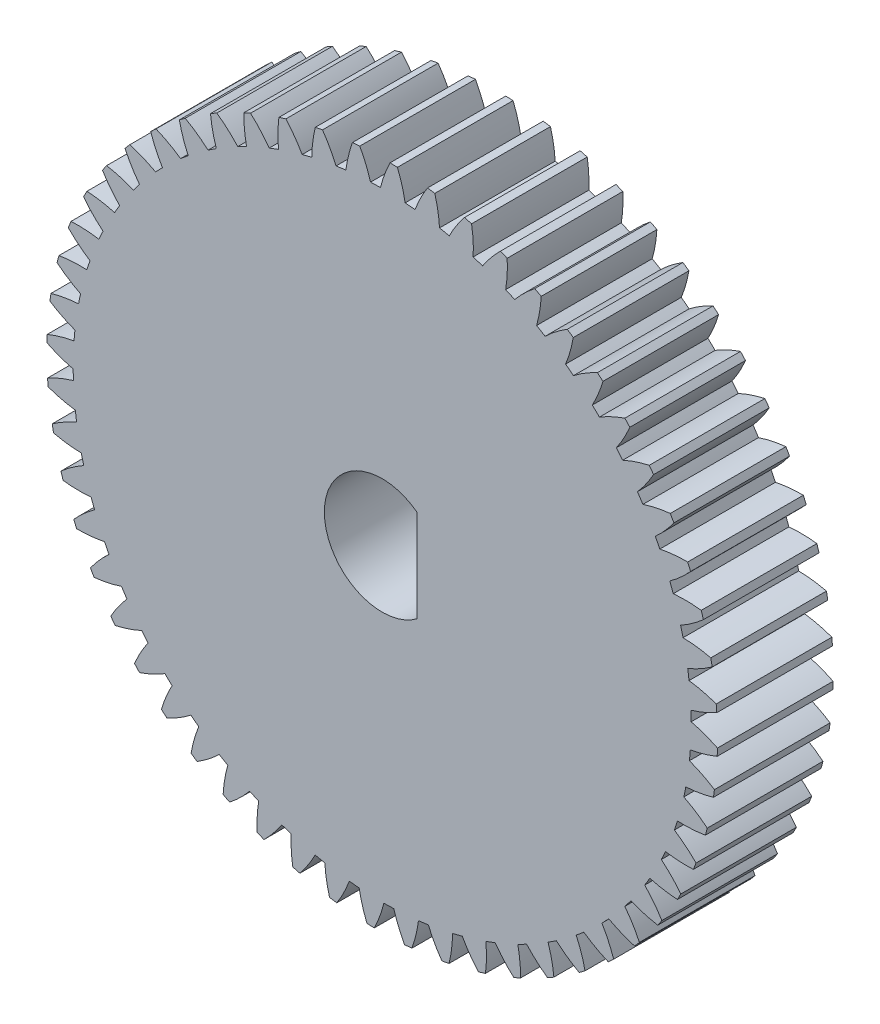
from build123d import *

# Parameters (mm, degrees)
BOSS_EXTRUDE1_DEPTH = 6.35


with BuildPart() as part:
    # Sketch1 → Boss-Extrude1 (new body)
    with BuildSketch(Plane.XY):
        with BuildLine():
            ThreePointArc((-17.851990054, 4.518702925), (-17.230016899, 4.06571305), (-16.562746604, 3.682567142))
            ThreePointArc((-16.562746604, 3.682567142), (-16.61965201, 3.416583514), (-16.672286231, 3.149721838))
            ThreePointArc((-16.672286231, 3.149721838), (-17.436587202, 3.060871069), (-18.186816361, 2.889971564))
            ThreePointArc((-18.186816361, 2.889971564), (-18.217335033, 2.690897492), (-18.245674693, 2.491501556))
            ThreePointArc((-18.245674693, 2.491501556), (-17.576893601, 2.110998884), (-16.870920231, 1.804972686))
            ThreePointArc((-16.870920231, 1.804972686), (-16.89768711, 1.534290124), (-16.92011135, 1.263213255))
            ThreePointArc((-16.92011135, 1.263213255), (-17.669658427, 1.089346603), (-18.396035629, 0.835522664))
            ThreePointArc((-18.396035629, 0.835522664), (-18.404073181, 0.63428332), (-18.409909386, 0.432968109))
            ThreePointArc((-18.409909386, 0.432968109), (-17.702730667, 0.129737682), (-16.966932247, -0.095320348))
            ThreePointArc((-16.966932247, -0.095320348), (-16.96322399, -0.367297855), (-16.955156252, -0.639180968))
            ThreePointArc((-16.955156252, -0.639180968), (-17.680523445, -0.895877029), (-18.373914076, -1.229433419))
            ThreePointArc((-18.373914076, -1.229433419), (-18.359369432, -1.430307332), (-18.342628788, -1.631010163))
            ThreePointArc((-18.342628788, -1.631010163), (-17.605945624, -1.853155046), (-16.849575245, -1.994414674))
            ThreePointArc((-16.849575245, -1.994414674), (-16.815438486, -2.26426685), (-16.776980226, -2.533537119))
            ThreePointArc((-16.776980226, -2.533537119), (-17.469045623, -2.869834487), (-18.120729892, -3.278928663))
            ThreePointArc((-18.120729892, -3.278928663), (-18.083785959, -3.47691104), (-18.04467899, -3.674477536))
            ThreePointArc((-18.04467899, -3.674477536), (-17.2877556, -3.812743274), (-16.520325059, -3.868428078))
            ThreePointArc((-16.520325059, -3.868428078), (-16.456189086, -4.132761376), (-16.38782394, -4.396032571))
            ThreePointArc((-16.38782394, -4.396032571), (-17.037884415, -4.807702111), (-17.639667016, -5.287189477))
            ThreePointArc((-17.639667016, -5.287189477), (-17.580788386, -5.479790574), (-17.519806883, -5.671736222))
            ThreePointArc((-17.519806883, -5.671736222), (-16.752162018, -5.724384043), (-15.983322199, -5.693793754))
            ThreePointArc((-15.983322199, -5.693793754), (-15.889993561, -5.94928403), (-15.792581259, -6.203245363))
            ThreePointArc((-15.792581259, -6.203245363), (-16.392461926, -6.685110092), (-16.936775092, -7.228960815))
            ThreePointArc((-16.936775092, -7.228960815), (-16.856702198, -7.413758562), (-16.77461304, -7.597669535))
            ThreePointArc((-16.77461304, -7.597669535), (-16.005900279, -7.564037362), (-15.245319789, -7.447556671))
            ThreePointArc((-15.245319789, -7.447556671), (-15.123972147, -7.690990985), (-14.998737705, -7.932448745))
            ThreePointArc((-14.998737705, -7.932448745), (-15.540894717, -8.478448934), (-16.020893395, -9.079823777))
            ThreePointArc((-16.020893395, -9.079823777), (-15.920633199, -9.254494235), (-15.818468705, -9.428057744))
            ThreePointArc((-15.818468705, -9.428057744), (-15.058355057, -9.308568522), (-14.315598637, -9.107662241))
            ThreePointArc((-14.315598637, -9.107662241), (-14.167758009, -9.335979266), (-14.016276323, -9.561896982))
            ThreePointArc((-14.016276323, -9.561896982), (-14.49389174, -10.165166362), (-14.903539668, -10.816502687))
            ThreePointArc((-14.903539668, -10.816502687), (-14.784353001, -10.978849273), (-14.663397948, -11.139882657))
            ThreePointArc((-14.663397948, -11.139882657), (-13.921442283, -10.936039031), (-13.205850527, -10.653233674))
            ThreePointArc((-13.205850527, -10.653233674), (-13.033376093, -10.863562191), (-12.857552133, -11.071098816))
            ThreePointArc((-12.857552133, -11.071098816), (-13.264619665, -11.724050925), (-13.598765282, -12.417157799))
            ThreePointArc((-13.598765282, -12.417157799), (-13.462150985, -12.565138911), (-13.323926454, -12.711617082))
            ThreePointArc((-13.323926454, -12.711617082), (-12.609459295, -12.425982505), (-11.930031183, -12.064834512))
            ThreePointArc((-11.930031183, -12.064834512), (-11.73509191, -12.254529518), (-11.537136765, -12.441075159))
            ThreePointArc((-11.537136765, -12.441075159), (-11.868537301, -13.135498745), (-12.122978533, -13.861659947))
            ThreePointArc((-12.122978533, -13.861659947), (-11.97065461, -13.993414637), (-11.816898854, -14.123495547))
            ThreePointArc((-11.816898854, -14.123495547), (-11.138905041, -13.759662039), (-10.504184776, -13.324713056))
            ThreePointArc((-10.504184776, -13.324713056), (-10.289232138, -13.491389026), (-10.071635208, -13.654597763))
            ThreePointArc((-10.071635208, -13.654597763), (-10.323201194, -14.381760047), (-10.494738294, -15.131843679))
            ThreePointArc((-10.494738294, -15.131843679), (-10.328620308, -15.245715055), (-10.161266894, -15.357762861))
            ThreePointArc((-10.161266894, -15.357762861), (-9.528272592, -14.92030584), (-8.94624215, -14.417025603))
            ThreePointArc((-8.94624215, -14.417025603), (-8.713979302, -14.55858649), (-8.479476995, -14.696405878))
            ThreePointArc((-8.479476995, -14.696405878), (-8.648044843, -15.447162372), (-8.734520632, -16.211735697))
            ThreePointArc((-8.734520632, -16.211735697), (-8.556697612, -16.30629176), (-8.377851108, -16.398897396))
            ThreePointArc((-8.377851108, -16.398897396), (-7.797816587, -15.893318137), (-7.275795339, -15.328035687))
            ThreePointArc((-7.275795339, -15.328035687), (-7.02914312, -15.442701281), (-6.780684439, -15.553398162))
            ThreePointArc((-6.780684439, -15.553398162), (-6.86413431, -16.318307667), (-6.864461306, -17.087755733))
            ThreePointArc((-6.864461306, -17.087755733), (-6.677169479, -17.161807386), (-6.489078983, -17.233806282))
            ThreePointArc((-6.489078983, -17.233806282), (-5.969298515, -16.666462738), (-5.513851179, -16.046286829))
            ThreePointArc((-5.513851179, -16.046286829), (-5.255911385, -16.132615143), (-4.996620842, -16.21479744))
            ThreePointArc((-4.996620842, -16.21479744), (-4.993903305, -16.984240776), (-4.908077396, -17.748887325))
            ThreePointArc((-4.908077396, -17.748887325), (-4.713672066, -17.801503326), (-4.518702925, -17.851990054))
            ThreePointArc((-4.518702925, -17.851990054), (-4.06571305, -17.230016899), (-3.682567142, -16.562746604))
            ThreePointArc((-3.682567142, -16.562746604), (-3.416583514, -16.61965201), (-3.149721838, -16.672286231))
            ThreePointArc((-3.149721838, -16.672286231), (-3.060871069, -17.436587202), (-2.889971564, -18.186816361))
            ThreePointArc((-2.889971564, -18.186816361), (-2.690897492, -18.217335033), (-2.491501556, -18.245674693))
            ThreePointArc((-2.491501556, -18.245674693), (-2.110998884, -17.576893601), (-1.804972686, -16.870920231))
            ThreePointArc((-1.804972686, -16.870920231), (-1.534290124, -16.89768711), (-1.263213255, -16.92011135))
            ThreePointArc((-1.263213255, -16.92011135), (-1.089346603, -17.669658427), (-0.835522664, -18.396035629))
            ThreePointArc((-0.835522664, -18.396035629), (-0.63428332, -18.404073181), (-0.432968109, -18.409909386))
            ThreePointArc((-0.432968109, -18.409909386), (-0.129737682, -17.702730667), (0.095320348, -16.966932247))
            ThreePointArc((0.095320348, -16.966932247), (0.367297855, -16.96322399), (0.639180968, -16.955156252))
            ThreePointArc((0.639180968, -16.955156252), (0.895877029, -17.680523445), (1.229433419, -18.373914076))
            ThreePointArc((1.229433419, -18.373914076), (1.430307332, -18.359369432), (1.631010163, -18.342628788))
            ThreePointArc((1.631010163, -18.342628788), (1.853155046, -17.605945624), (1.994414674, -16.849575245))
            ThreePointArc((1.994414674, -16.849575245), (2.26426685, -16.815438486), (2.533537119, -16.776980226))
            ThreePointArc((2.533537119, -16.776980226), (2.869834487, -17.469045623), (3.278928663, -18.120729892))
            ThreePointArc((3.278928663, -18.120729892), (3.47691104, -18.083785959), (3.674477536, -18.04467899))
            ThreePointArc((3.674477536, -18.04467899), (3.812743274, -17.2877556), (3.868428078, -16.520325059))
            ThreePointArc((3.868428078, -16.520325059), (4.132761376, -16.456189086), (4.396032571, -16.38782394))
            ThreePointArc((4.396032571, -16.38782394), (4.807702111, -17.037884415), (5.287189477, -17.639667016))
            ThreePointArc((5.287189477, -17.639667016), (5.479790574, -17.580788386), (5.671736222, -17.519806883))
            ThreePointArc((5.671736222, -17.519806883), (5.724384043, -16.752162018), (5.693793754, -15.983322199))
            ThreePointArc((5.693793754, -15.983322199), (5.94928403, -15.889993561), (6.203245363, -15.792581259))
            ThreePointArc((6.203245363, -15.792581259), (6.685110092, -16.392461926), (7.228960815, -16.936775092))
            ThreePointArc((7.228960815, -16.936775092), (7.413758562, -16.856702198), (7.597669535, -16.77461304))
            ThreePointArc((7.597669535, -16.77461304), (7.564037362, -16.005900279), (7.447556671, -15.245319789))
            ThreePointArc((7.447556671, -15.245319789), (7.690990985, -15.123972147), (7.932448745, -14.998737705))
            ThreePointArc((7.932448745, -14.998737705), (8.478448934, -15.540894717), (9.079823777, -16.020893395))
            ThreePointArc((9.079823777, -16.020893395), (9.254494235, -15.920633199), (9.428057744, -15.818468705))
            ThreePointArc((9.428057744, -15.818468705), (9.308568522, -15.058355057), (9.107662241, -14.315598637))
            ThreePointArc((9.107662241, -14.315598637), (9.335979266, -14.167758009), (9.561896982, -14.016276323))
            ThreePointArc((9.561896982, -14.016276323), (10.165166362, -14.49389174), (10.816502687, -14.903539668))
            ThreePointArc((10.816502687, -14.903539668), (10.978849273, -14.784353001), (11.139882657, -14.663397948))
            ThreePointArc((11.139882657, -14.663397948), (10.936039031, -13.921442283), (10.653233674, -13.205850527))
            ThreePointArc((10.653233674, -13.205850527), (10.863562191, -13.033376093), (11.071098816, -12.857552133))
            ThreePointArc((11.071098816, -12.857552133), (11.724050925, -13.264619665), (12.417157799, -13.598765282))
            ThreePointArc((12.417157799, -13.598765282), (12.565138911, -13.462150985), (12.711617082, -13.323926454))
            ThreePointArc((12.711617082, -13.323926454), (12.425982505, -12.609459295), (12.064834512, -11.930031183))
            ThreePointArc((12.064834512, -11.930031183), (12.254529518, -11.73509191), (12.441075159, -11.537136765))
            ThreePointArc((12.441075159, -11.537136765), (13.135498745, -11.868537301), (13.861659947, -12.122978533))
            ThreePointArc((13.861659947, -12.122978533), (13.993414637, -11.97065461), (14.123495547, -11.816898854))
            ThreePointArc((14.123495547, -11.816898854), (13.759662039, -11.138905041), (13.324713056, -10.504184776))
            ThreePointArc((13.324713056, -10.504184776), (13.491389026, -10.289232138), (13.654597763, -10.071635208))
            ThreePointArc((13.654597763, -10.071635208), (14.381760047, -10.323201194), (15.131843679, -10.494738294))
            ThreePointArc((15.131843679, -10.494738294), (15.245715055, -10.328620308), (15.357762861, -10.161266894))
            ThreePointArc((15.357762861, -10.161266894), (14.92030584, -9.528272592), (14.417025603, -8.94624215))
            ThreePointArc((14.417025603, -8.94624215), (14.55858649, -8.713979302), (14.696405878, -8.479476995))
            ThreePointArc((14.696405878, -8.479476995), (15.447162372, -8.648044843), (16.211735697, -8.734520632))
            ThreePointArc((16.211735697, -8.734520632), (16.30629176, -8.556697612), (16.398897396, -8.377851108))
            ThreePointArc((16.398897396, -8.377851108), (15.893318137, -7.797816587), (15.328035687, -7.275795339))
            ThreePointArc((15.328035687, -7.275795339), (15.442701281, -7.02914312), (15.553398162, -6.780684439))
            ThreePointArc((15.553398162, -6.780684439), (16.318307667, -6.86413431), (17.087755733, -6.864461306))
            ThreePointArc((17.087755733, -6.864461306), (17.161807386, -6.677169479), (17.233806282, -6.489078983))
            ThreePointArc((17.233806282, -6.489078983), (16.666462738, -5.969298515), (16.046286829, -5.513851179))
            ThreePointArc((16.046286829, -5.513851179), (16.132615143, -5.255911385), (16.21479744, -4.996620842))
            ThreePointArc((16.21479744, -4.996620842), (16.984240776, -4.993903305), (17.748887325, -4.908077396))
            ThreePointArc((17.748887325, -4.908077396), (17.801503326, -4.713672066), (17.851990054, -4.518702925))
            ThreePointArc((17.851990054, -4.518702925), (17.230016899, -4.06571305), (16.562746604, -3.682567142))
            ThreePointArc((16.562746604, -3.682567142), (16.61965201, -3.416583514), (16.672286231, -3.149721838))
            ThreePointArc((16.672286231, -3.149721838), (17.436587202, -3.060871069), (18.186816361, -2.889971564))
            ThreePointArc((18.186816361, -2.889971564), (18.217335033, -2.690897492), (18.245674693, -2.491501556))
            ThreePointArc((18.245674693, -2.491501556), (17.576893601, -2.110998884), (16.870920231, -1.804972686))
            ThreePointArc((16.870920231, -1.804972686), (16.89768711, -1.534290124), (16.92011135, -1.263213255))
            ThreePointArc((16.92011135, -1.263213255), (17.669658427, -1.089346603), (18.396035629, -0.835522664))
            ThreePointArc((18.396035629, -0.835522664), (18.404073181, -0.63428332), (18.409909386, -0.432968109))
            ThreePointArc((18.409909386, -0.432968109), (17.702730667, -0.129737682), (16.966932247, 0.095320348))
            ThreePointArc((16.966932247, 0.095320348), (16.96322399, 0.367297855), (16.955156252, 0.639180968))
            ThreePointArc((16.955156252, 0.639180968), (17.680523445, 0.895877029), (18.373914076, 1.229433419))
            ThreePointArc((18.373914076, 1.229433419), (18.359369432, 1.430307332), (18.342628788, 1.631010163))
            ThreePointArc((18.342628788, 1.631010163), (17.605945624, 1.853155046), (16.849575245, 1.994414674))
            ThreePointArc((16.849575245, 1.994414674), (16.815438486, 2.26426685), (16.776980226, 2.533537119))
            ThreePointArc((16.776980226, 2.533537119), (17.469045623, 2.869834487), (18.120729892, 3.278928663))
            ThreePointArc((18.120729892, 3.278928663), (18.083785959, 3.47691104), (18.04467899, 3.674477536))
            ThreePointArc((18.04467899, 3.674477536), (17.2877556, 3.812743274), (16.520325059, 3.868428078))
            ThreePointArc((16.520325059, 3.868428078), (16.456189086, 4.132761376), (16.38782394, 4.396032571))
            ThreePointArc((16.38782394, 4.396032571), (17.037884415, 4.807702111), (17.639667016, 5.287189477))
            ThreePointArc((17.639667016, 5.287189477), (17.580788386, 5.479790574), (17.519806883, 5.671736222))
            ThreePointArc((17.519806883, 5.671736222), (16.752162018, 5.724384043), (15.983322199, 5.693793754))
            ThreePointArc((15.983322199, 5.693793754), (15.889993561, 5.94928403), (15.792581259, 6.203245363))
            ThreePointArc((15.792581259, 6.203245363), (16.392461926, 6.685110092), (16.936775092, 7.228960815))
            ThreePointArc((16.936775092, 7.228960815), (16.856702198, 7.413758562), (16.77461304, 7.597669535))
            ThreePointArc((16.77461304, 7.597669535), (16.005900279, 7.564037362), (15.245319789, 7.447556671))
            ThreePointArc((15.245319789, 7.447556671), (15.123972147, 7.690990985), (14.998737705, 7.932448745))
            ThreePointArc((14.998737705, 7.932448745), (15.540894717, 8.478448934), (16.020893395, 9.079823777))
            ThreePointArc((16.020893395, 9.079823777), (15.920633199, 9.254494235), (15.818468705, 9.428057744))
            ThreePointArc((15.818468705, 9.428057744), (15.058355057, 9.308568522), (14.315598637, 9.107662241))
            ThreePointArc((14.315598637, 9.107662241), (14.167758009, 9.335979266), (14.016276323, 9.561896982))
            ThreePointArc((14.016276323, 9.561896982), (14.49389174, 10.165166362), (14.903539668, 10.816502687))
            ThreePointArc((14.903539668, 10.816502687), (14.784353001, 10.978849273), (14.663397948, 11.139882657))
            ThreePointArc((14.663397948, 11.139882657), (13.921442283, 10.936039031), (13.205850527, 10.653233674))
            ThreePointArc((13.205850527, 10.653233674), (13.033376093, 10.863562191), (12.857552133, 11.071098816))
            ThreePointArc((12.857552133, 11.071098816), (13.264619665, 11.724050925), (13.598765282, 12.417157799))
            ThreePointArc((13.598765282, 12.417157799), (13.462150985, 12.565138911), (13.323926454, 12.711617082))
            ThreePointArc((13.323926454, 12.711617082), (12.609459295, 12.425982505), (11.930031183, 12.064834512))
            ThreePointArc((11.930031183, 12.064834512), (11.73509191, 12.254529518), (11.537136765, 12.441075159))
            ThreePointArc((11.537136765, 12.441075159), (11.868537301, 13.135498745), (12.122978533, 13.861659947))
            ThreePointArc((12.122978533, 13.861659947), (11.97065461, 13.993414637), (11.816898854, 14.123495547))
            ThreePointArc((11.816898854, 14.123495547), (11.138905041, 13.759662039), (10.504184776, 13.324713056))
            ThreePointArc((10.504184776, 13.324713056), (10.289232138, 13.491389026), (10.071635208, 13.654597763))
            ThreePointArc((10.071635208, 13.654597763), (10.323201194, 14.381760047), (10.494738294, 15.131843679))
            ThreePointArc((10.494738294, 15.131843679), (10.328620308, 15.245715055), (10.161266894, 15.357762861))
            ThreePointArc((10.161266894, 15.357762861), (9.528272592, 14.92030584), (8.94624215, 14.417025603))
            ThreePointArc((8.94624215, 14.417025603), (8.713979302, 14.55858649), (8.479476995, 14.696405878))
            ThreePointArc((8.479476995, 14.696405878), (8.648044843, 15.447162372), (8.734520632, 16.211735697))
            ThreePointArc((8.734520632, 16.211735697), (8.556697612, 16.30629176), (8.377851108, 16.398897396))
            ThreePointArc((8.377851108, 16.398897396), (7.797816587, 15.893318137), (7.275795339, 15.328035687))
            ThreePointArc((7.275795339, 15.328035687), (7.02914312, 15.442701281), (6.780684439, 15.553398162))
            ThreePointArc((6.780684439, 15.553398162), (6.86413431, 16.318307667), (6.864461306, 17.087755733))
            ThreePointArc((6.864461306, 17.087755733), (6.677169479, 17.161807386), (6.489078983, 17.233806282))
            ThreePointArc((6.489078983, 17.233806282), (5.969298515, 16.666462738), (5.513851179, 16.046286829))
            ThreePointArc((5.513851179, 16.046286829), (5.255911385, 16.132615143), (4.996620842, 16.21479744))
            ThreePointArc((4.996620842, 16.21479744), (4.993903305, 16.984240776), (4.908077396, 17.748887325))
            ThreePointArc((4.908077396, 17.748887325), (4.713672066, 17.801503326), (4.518702925, 17.851990054))
            ThreePointArc((4.518702925, 17.851990054), (4.06571305, 17.230016899), (3.682567142, 16.562746604))
            ThreePointArc((3.682567142, 16.562746604), (3.416583514, 16.61965201), (3.149721838, 16.672286231))
            ThreePointArc((3.149721838, 16.672286231), (3.060871069, 17.436587202), (2.889971564, 18.186816361))
            ThreePointArc((2.889971564, 18.186816361), (2.690897492, 18.217335033), (2.491501556, 18.245674693))
            ThreePointArc((2.491501556, 18.245674693), (2.110998884, 17.576893601), (1.804972686, 16.870920231))
            ThreePointArc((1.804972686, 16.870920231), (1.534290124, 16.89768711), (1.263213255, 16.92011135))
            ThreePointArc((1.263213255, 16.92011135), (1.089346603, 17.669658427), (0.835522664, 18.396035629))
            ThreePointArc((0.835522664, 18.396035629), (0.63428332, 18.404073181), (0.432968109, 18.409909386))
            ThreePointArc((0.432968109, 18.409909386), (0.129737682, 17.702730667), (-0.095320348, 16.966932247))
            ThreePointArc((-0.095320348, 16.966932247), (-0.367297855, 16.96322399), (-0.639180968, 16.955156252))
            ThreePointArc((-0.639180968, 16.955156252), (-0.895877029, 17.680523445), (-1.229433419, 18.373914076))
            ThreePointArc((-1.229433419, 18.373914076), (-1.430307332, 18.359369432), (-1.631010163, 18.342628788))
            ThreePointArc((-1.631010163, 18.342628788), (-1.853155046, 17.605945624), (-1.994414674, 16.849575245))
            ThreePointArc((-1.994414674, 16.849575245), (-2.26426685, 16.815438486), (-2.533537119, 16.776980226))
            ThreePointArc((-2.533537119, 16.776980226), (-2.869834487, 17.469045623), (-3.278928663, 18.120729892))
            ThreePointArc((-3.278928663, 18.120729892), (-3.47691104, 18.083785959), (-3.674477536, 18.04467899))
            ThreePointArc((-3.674477536, 18.04467899), (-3.812743274, 17.2877556), (-3.868428078, 16.520325059))
            ThreePointArc((-3.868428078, 16.520325059), (-4.132761376, 16.456189086), (-4.396032571, 16.38782394))
            ThreePointArc((-4.396032571, 16.38782394), (-4.807702111, 17.037884415), (-5.287189477, 17.639667016))
            ThreePointArc((-5.287189477, 17.639667016), (-5.479790574, 17.580788386), (-5.671736222, 17.519806883))
            ThreePointArc((-5.671736222, 17.519806883), (-5.724384043, 16.752162018), (-5.693793754, 15.983322199))
            ThreePointArc((-5.693793754, 15.983322199), (-5.94928403, 15.889993561), (-6.203245363, 15.792581259))
            ThreePointArc((-6.203245363, 15.792581259), (-6.685110092, 16.392461926), (-7.228960815, 16.936775092))
            ThreePointArc((-7.228960815, 16.936775092), (-7.413758562, 16.856702198), (-7.597669535, 16.77461304))
            ThreePointArc((-7.597669535, 16.77461304), (-7.564037362, 16.005900279), (-7.447556671, 15.245319789))
            ThreePointArc((-7.447556671, 15.245319789), (-7.690990985, 15.123972147), (-7.932448745, 14.998737705))
            ThreePointArc((-7.932448745, 14.998737705), (-8.478448934, 15.540894717), (-9.079823777, 16.020893395))
            ThreePointArc((-9.079823777, 16.020893395), (-9.254494235, 15.920633199), (-9.428057744, 15.818468705))
            ThreePointArc((-9.428057744, 15.818468705), (-9.308568522, 15.058355057), (-9.107662241, 14.315598637))
            ThreePointArc((-9.107662241, 14.315598637), (-9.335979266, 14.167758009), (-9.561896982, 14.016276323))
            ThreePointArc((-9.561896982, 14.016276323), (-10.165166362, 14.49389174), (-10.816502687, 14.903539668))
            ThreePointArc((-10.816502687, 14.903539668), (-10.978849273, 14.784353001), (-11.139882657, 14.663397948))
            ThreePointArc((-11.139882657, 14.663397948), (-10.936039031, 13.921442283), (-10.653233674, 13.205850527))
            ThreePointArc((-10.653233674, 13.205850527), (-10.863562191, 13.033376093), (-11.071098816, 12.857552133))
            ThreePointArc((-11.071098816, 12.857552133), (-11.724050925, 13.264619665), (-12.417157799, 13.598765282))
            ThreePointArc((-12.417157799, 13.598765282), (-12.565138911, 13.462150985), (-12.711617082, 13.323926454))
            ThreePointArc((-12.711617082, 13.323926454), (-12.425982505, 12.609459295), (-12.064834512, 11.930031183))
            ThreePointArc((-12.064834512, 11.930031183), (-12.254529518, 11.73509191), (-12.441075159, 11.537136765))
            ThreePointArc((-12.441075159, 11.537136765), (-13.135498745, 11.868537301), (-13.861659947, 12.122978533))
            ThreePointArc((-13.861659947, 12.122978533), (-13.993414637, 11.97065461), (-14.123495547, 11.816898854))
            ThreePointArc((-14.123495547, 11.816898854), (-13.759662039, 11.138905041), (-13.324713056, 10.504184776))
            ThreePointArc((-13.324713056, 10.504184776), (-13.491389026, 10.289232138), (-13.654597763, 10.071635208))
            ThreePointArc((-13.654597763, 10.071635208), (-14.381760047, 10.323201194), (-15.131843679, 10.494738294))
            ThreePointArc((-15.131843679, 10.494738294), (-15.245715055, 10.328620308), (-15.357762861, 10.161266894))
            ThreePointArc((-15.357762861, 10.161266894), (-14.92030584, 9.528272592), (-14.417025603, 8.94624215))
            ThreePointArc((-14.417025603, 8.94624215), (-14.55858649, 8.713979302), (-14.696405878, 8.479476995))
            ThreePointArc((-14.696405878, 8.479476995), (-15.447162372, 8.648044843), (-16.211735697, 8.734520632))
            ThreePointArc((-16.211735697, 8.734520632), (-16.30629176, 8.556697612), (-16.398897396, 8.377851108))
            ThreePointArc((-16.398897396, 8.377851108), (-15.893318137, 7.797816587), (-15.328035687, 7.275795339))
            ThreePointArc((-15.328035687, 7.275795339), (-15.442701281, 7.02914312), (-15.553398162, 6.780684439))
            ThreePointArc((-15.553398162, 6.780684439), (-16.318307667, 6.86413431), (-17.087755733, 6.864461306))
            ThreePointArc((-17.087755733, 6.864461306), (-17.161807386, 6.677169479), (-17.233806282, 6.489078983))
            ThreePointArc((-17.233806282, 6.489078983), (-16.666462738, 5.969298515), (-16.046286829, 5.513851179))
            ThreePointArc((-16.046286829, 5.513851179), (-16.132615143, 5.255911385), (-16.21479744, 4.996620842))
            ThreePointArc((-16.21479744, 4.996620842), (-16.984240776, 4.993903305), (-17.748887325, 4.908077396))
            ThreePointArc((-17.748887325, 4.908077396), (-17.801503326, 4.713672066), (-17.851990054, 4.518702925))
        make_face()
        with BuildLine():
            Line((1.905, -2.54), (1.905, 2.54))
            ThreePointArc((1.905, 2.54), (-3.175, 0), (1.905, -2.54))
        make_face(mode=Mode.SUBTRACT)
    extrude(amount=BOSS_EXTRUDE1_DEPTH)


solid = part.part
